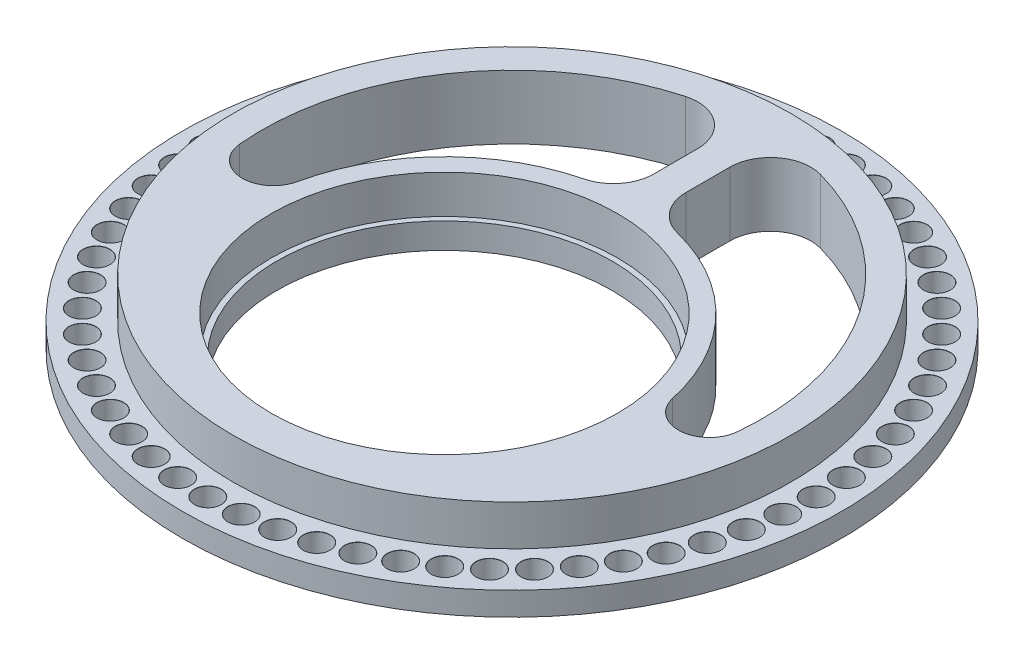
from build123d import *

# Parameters (mm, degrees)
SLOTTED_BODY_EXTRUDE_DEPTH      = 4.191
SLOTTED_BODY_EXTRUDE_DEPTH_BACK = 0.2032
SKETCH1_R                       = 61.9125
SKETCH1_R_2                     = 30.988
SKETCH5_R                       = 52.3875
BOSS_EXTRUDE3_DEPTH             = 7.62
SKETCH6_R                       = 32.512
CUT_EXTRUDE5_DEPTH              = 89.377917571
SKETCH8_R                       = 32.512
SKETCH8_R_2                     = 31.496
BOSS_EXTRUDE4_DEPTH             = 4.795000062
CIRPATTERN1_COUNT               = 60


with BuildPart() as part:
    # Sketch1 → Slotted-Body Extrude (new, two sides: drawn at the far end of the back side and taken through both)
    with BuildSketch(Plane(origin=(0, 0, 0), x_dir=(1, 0, 0), z_dir=(0, 1, 0)).offset(-SLOTTED_BODY_EXTRUDE_DEPTH_BACK)):
        with Locations(Location((0, 0, 0), (0, 0, 270))):
            Circle(SKETCH1_R)
        with Locations(Location((0, -12.7, 0), (0, 0, 270))):
            Circle(SKETCH1_R_2, mode=Mode.SUBTRACT)
    extrude(amount=SLOTTED_BODY_EXTRUDE_DEPTH + SLOTTED_BODY_EXTRUDE_DEPTH_BACK)

    # Sketch5 → Boss-Extrude3 (add)
    with BuildSketch(Plane(origin=(0, 4.191, 0), x_dir=(1, 0, 0), z_dir=(0, 1, 0))):
        with Locations(Location((0, 0, 0), (0, 0, 90))):
            Circle(SKETCH5_R)
    extrude(amount=BOSS_EXTRUDE3_DEPTH)

    # Sketch6 → Cut-Extrude5 (cut, through all)
    with BuildSketch(Plane.XZ.offset(0.2032)):
        with Locations(Location((0, 12.7, 0), (0, 0, 270))):
            Circle(SKETCH6_R)
        with BuildLine():
            Line((3.013951015, -37.906674687), (3.013951015, -29.674053734))
            ThreePointArc((3.013951015, -29.674053734), (4.62572071, -24.987309811), (8.779192117, -22.283230408))
            ThreePointArc((8.779192117, -22.283230408), (25.925135322, -12.375645206), (35.256203169, 5.09074497))
            ThreePointArc((35.256203169, 5.09074497), (41.313127715, 9.689980346), (46.782976949, 4.406037654))
            ThreePointArc((46.782976949, 4.406037654), (38.737451576, -26.59830719), (12.692135082, -45.243450433))
            ThreePointArc((12.692135082, -45.243450433), (6.03063496, -43.979061474), (3.013951015, -37.906674687))
        make_face()
        with BuildLine():
            Line((-3.013951015, -37.906674687), (-3.013951015, -29.674053734))
            ThreePointArc((-3.013951015, -29.674053734), (-4.62572071, -24.987309811), (-8.779192117, -22.283230408))
            ThreePointArc((-8.779192117, -22.283230408), (-25.925135322, -12.375645206), (-35.256203169, 5.09074497))
            ThreePointArc((-35.256203169, 5.09074497), (-41.313127715, 9.689980346), (-46.782976949, 4.406037654))
            ThreePointArc((-46.782976949, 4.406037654), (-38.737451576, -26.59830719), (-12.692135082, -45.243450433))
            ThreePointArc((-12.692135082, -45.243450433), (-6.03063496, -43.979061474), (-3.013951015, -37.906674687))
        make_face()
    extrude(amount=-CUT_EXTRUDE5_DEPTH, mode=Mode.SUBTRACT)

    # Sketch10 → Ø5.0mm Dowel Hole2 (revolve, cut)
    with BuildSketch(Plane(origin=(0, 4.191, -57.15), x_dir=(0, 0, 1), z_dir=(1, 0, 0))):
        Polygon((0, 0), (0, 4.3942), (2.5, 4.3942), (2.5, 0.025), (2.525, 0), align=None)
    f_5_0mm_dowel_hole2 = revolve(axis=Axis((0, 10.541, -57.15), (0, -1, 0)), mode=Mode.SUBTRACT)

    # CirPattern1: Ø5.0mm Dowel Hole2 ×60 about axis
    cirpattern1_axis = Axis((0, 0, 0), (0, 1, 0))
    for i in range(1, CIRPATTERN1_COUNT):
        add(f_5_0mm_dowel_hole2.rotate(cirpattern1_axis, i * 360 / CIRPATTERN1_COUNT), mode=Mode.SUBTRACT)


with BuildPart() as body_2:
    # Sketch8 → Boss-Extrude4 (new body)
    with BuildSketch(Plane.XZ.offset(0.2032)):
        with Locations(Location((0, 12.7, 0), (0, 0, 270))):
            Circle(SKETCH8_R)
        with Locations(Location((0, 12.7, 0), (0, 0, 270))):
            Circle(SKETCH8_R_2, mode=Mode.SUBTRACT)
    extrude(amount=-BOSS_EXTRUDE4_DEPTH)


solid = Compound([part.part, body_2.part])
